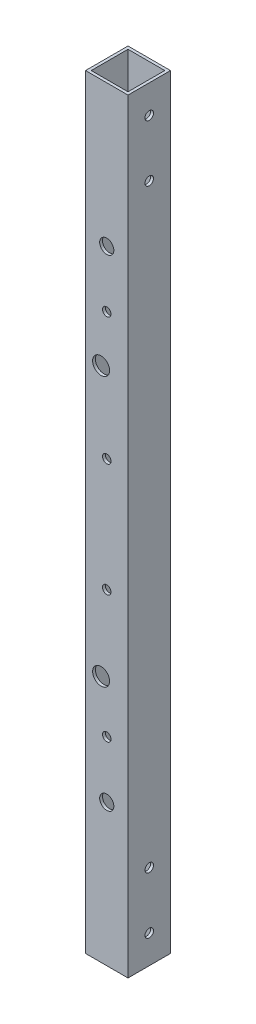
from build123d import *

# Parameters (mm, degrees)
SKETCH_1_W          = 15
SKETCH_1_H          = 15
SKETCH_1_W_2        = 13
SKETCH_1_H_2        = 13
EXTRUDE_1_DEPTH     = 270
SKETCH_2_R          = 1.5
SKETCH_2_R_2        = 2.5
SKETCH_2_R_3        = 3
CUT_EXTRUDE_1_DEPTH = 271.520331953
SKETCH_3_R          = 1.5
CUT_EXTRUDE_2_DEPTH = 271.520331953


with BuildPart() as part:
    # 草图1 → 凸台-拉伸1 (new body)
    with BuildSketch(Plane(origin=(0, 0, 0), x_dir=(1, 0, 0), z_dir=(0, 1, 0))):
        Rectangle(SKETCH_1_W, SKETCH_1_H)
        Rectangle(SKETCH_1_W_2, SKETCH_1_H_2, mode=Mode.SUBTRACT)
    extrude(amount=EXTRUDE_1_DEPTH)

    # 草图2 → 切除-拉伸1 (cut, through all)
    with BuildSketch(Plane.XY.offset(7.5)):
        with Locations((0, 155)):
            Circle(SKETCH_2_R)
        with Locations((0, 115)):
            Circle(SKETCH_2_R)
        with Locations((0, 200)):
            Circle(SKETCH_2_R)
        with Locations((0, 70)):
            Circle(SKETCH_2_R)
        with Locations((0, 220)):
            Circle(SKETCH_2_R_2)
        with Locations((0, 50)):
            Circle(SKETCH_2_R_2)
        with Locations((-2, 182.5)):
            Circle(SKETCH_2_R_3)
        with Locations((-2, 87.5)):
            Circle(SKETCH_2_R_3)
    extrude(amount=-CUT_EXTRUDE_1_DEPTH, mode=Mode.SUBTRACT)

    # 草图3 → 切除-拉伸2 (cut, through all)
    with BuildSketch(Plane(origin=(7.5, 0, 0), x_dir=(0, 0, -1), z_dir=(1, 0, 0))):
        with Locations((0, 240)):
            Circle(SKETCH_3_R)
        with Locations((0, 30)):
            Circle(SKETCH_3_R)
        with Locations((0, 10)):
            Circle(SKETCH_3_R)
        with Locations((0, 260)):
            Circle(SKETCH_3_R)
    extrude(amount=-CUT_EXTRUDE_2_DEPTH, mode=Mode.SUBTRACT)


solid = part.part
